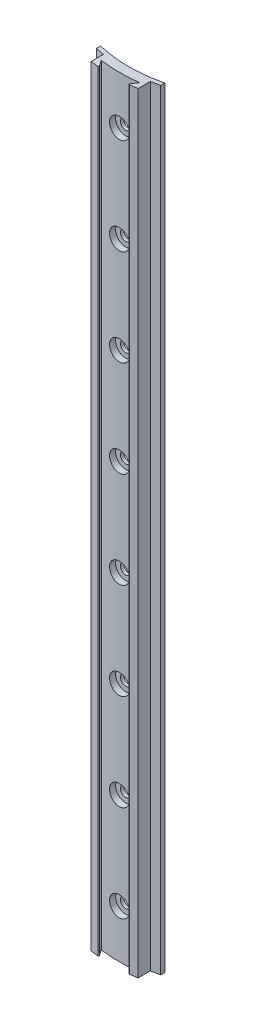
from build123d import *

# Parameters (mm, degrees)
BOSS_EXTRUDE1_DEPTH = 240
CUT_EXTRUDE3_DEPTH  = 245.479549247
BOSS_EXTRUDE2_DEPTH = 240
SKETCH3_R           = 1.625
CUT_EXTRUDE4_DEPTH  = 270
SKETCH3_5_R         = 3.125
SKETCH3_5_R_2       = 1.625
CUT_EXTRUDE5_DEPTH  = 2
CUT_EXTRUDE6_DEPTH  = 245.810237745


with BuildPart() as part:
    # Sketch2 → Boss-Extrude1 (new body)
    with BuildSketch(Plane(origin=(0, 15, 0), x_dir=(1, 0, 0), z_dir=(0, 1, 0))):
        with BuildLine():
            Line((-10, -44.38749824), (-10, -41.306779105))
            ThreePointArc((-10, -41.306779105), (0, -42.5), (10, -41.306779105))
            Line((10, -41.306779105), (10, -44.38749824))
            ThreePointArc((10, -44.38749824), (0, -45.5), (-10, -44.38749824))
        make_face()
    extrude(amount=BOSS_EXTRUDE1_DEPTH)

    # Sketch5 → Cut-Extrude3 (cut, through all)
    with BuildSketch(Plane(origin=(0, 255, 0), x_dir=(1, 0, 0), z_dir=(0, 1, 0))):
        with BuildLine():
            Line((-8, -42.991182168), (-8, -44.791182168))
            ThreePointArc((-8, -44.791182168), (-9.002263059, -44.600552237), (-10, -44.38749824))
            Line((-10, -44.38749824), (-10, -42.570432746))
            ThreePointArc((-10, -42.570432746), (-9.002458415, -42.792493345), (-8, -42.991182168))
        make_face()
        with BuildLine():
            Line((8, -44.791182168), (8, -42.991182168))
            ThreePointArc((8, -42.991182168), (9.002458415, -42.792493345), (10, -42.570432746))
            Line((10, -42.570432746), (10, -44.38749824))
            ThreePointArc((10, -44.38749824), (9.002263059, -44.600552237), (8, -44.791182168))
        make_face()
    extrude(amount=-CUT_EXTRUDE3_DEPTH, mode=Mode.SUBTRACT)

    # Sketch6 → Boss-Extrude2 (add, through all)
    with BuildSketch(Plane(origin=(0, 255, 0), x_dir=(1, 0, 0), z_dir=(0, 1, 0))):
        with BuildLine():
            Line((-8, -44.791182168), (-8, -46.821469434))
            ThreePointArc((-8, -46.821469434), (-6.468173714, -47.057546991), (-4.929460777, -47.243522481))
            ThreePointArc((-4.929460777, -47.243522481), (-4.736798282, -47.146817981), (-4.743851161, -46.931362988))
            Line((-4.743851161, -46.931362988), (-6, -45.102660675))
            ThreePointArc((-6, -45.102660675), (-7.001732265, -44.958044278), (-8, -44.791182168))
        make_face()
        with BuildLine():
            Line((8, -44.791182168), (8, -46.821469434))
            ThreePointArc((8, -46.821469434), (6.468173714, -47.057546991), (4.929460777, -47.243522481))
            ThreePointArc((4.929460777, -47.243522481), (4.736798282, -47.146817981), (4.743851161, -46.931362988))
            Line((4.743851161, -46.931362988), (6, -45.102660675))
            ThreePointArc((6, -45.102660675), (7.001732265, -44.958044278), (8, -44.791182168))
        make_face()
    extrude(amount=-BOSS_EXTRUDE2_DEPTH)

    # Sketch3 → Cut-Extrude4 (cut)
    with BuildSketch(Plane.XY.offset(45.5)):
        with Locations((0, 30)):
            Circle(SKETCH3_R)
        with Locations((0, 60)):
            Circle(SKETCH3_R)
        with Locations((0, 90)):
            Circle(SKETCH3_R)
        with Locations((0, 120)):
            Circle(SKETCH3_R)
        with Locations((0, 150)):
            Circle(SKETCH3_R)
        with Locations((0, 180)):
            Circle(SKETCH3_R)
        with Locations((0, 210)):
            Circle(SKETCH3_R)
        with Locations((0, 240)):
            Circle(SKETCH3_R)
    extrude(amount=-CUT_EXTRUDE4_DEPTH, mode=Mode.SUBTRACT)

    # Sketch3<5> → Cut-Extrude5 (cut)
    # profile 1 of 8: a face of its own
    with BuildSketch(Plane.XY.offset(45.5)):
        with Locations((0, 30)):
            Circle(SKETCH3_5_R)
        with Locations((0, 30)):
            Circle(SKETCH3_5_R_2, mode=Mode.SUBTRACT)
    # profile 2 of 8: a face of its own
    with BuildSketch(Plane.XY.offset(45.5)):
        with Locations((0, 60)):
            Circle(SKETCH3_5_R)
        with Locations((0, 60)):
            Circle(SKETCH3_5_R_2, mode=Mode.SUBTRACT)
    # profile 3 of 8: a face of its own
    with BuildSketch(Plane.XY.offset(45.5)):
        with Locations((0, 90)):
            Circle(SKETCH3_5_R)
        with Locations((0, 90)):
            Circle(SKETCH3_5_R_2, mode=Mode.SUBTRACT)
    # profile 4 of 8: a face of its own
    with BuildSketch(Plane.XY.offset(45.5)):
        with Locations((0, 120)):
            Circle(SKETCH3_5_R)
        with Locations((0, 120)):
            Circle(SKETCH3_5_R_2, mode=Mode.SUBTRACT)
    # profile 5 of 8: a face of its own
    with BuildSketch(Plane.XY.offset(45.5)):
        with Locations((0, 150)):
            Circle(SKETCH3_5_R)
        with Locations((0, 150)):
            Circle(SKETCH3_5_R_2, mode=Mode.SUBTRACT)
    # profile 6 of 8: a face of its own
    with BuildSketch(Plane.XY.offset(45.5)):
        with Locations((0, 180)):
            Circle(SKETCH3_5_R)
        with Locations((0, 180)):
            Circle(SKETCH3_5_R_2, mode=Mode.SUBTRACT)
    # profile 7 of 8: a face of its own
    with BuildSketch(Plane.XY.offset(45.5)):
        with Locations((0, 210)):
            Circle(SKETCH3_5_R)
        with Locations((0, 210)):
            Circle(SKETCH3_5_R_2, mode=Mode.SUBTRACT)
    # profile 8 of 8: a face of its own
    with BuildSketch(Plane.XY.offset(45.5)):
        with Locations((0, 240)):
            Circle(SKETCH3_5_R)
        with Locations((0, 240)):
            Circle(SKETCH3_5_R_2, mode=Mode.SUBTRACT)
    extrude(amount=-CUT_EXTRUDE5_DEPTH, mode=Mode.SUBTRACT)

    # Sketch8 → Cut-Extrude6 (cut, through all)
    with BuildSketch(Plane(origin=(0, 255, 0), x_dir=(1, 0, 0), z_dir=(0, 1, 0))):
        with BuildLine():
            Line((-7.3, -48.974342188), (-7.3, -43.115562668))
            ThreePointArc((-7.3, -43.115562668), (-8.65429325, -42.86426195), (-10, -42.570432746))
            Line((-10, -42.570432746), (-7.3, -48.974342188))
        make_face()
        with BuildLine():
            Line((7.3, -43.115562668), (7.3, -48.974342188))
            Line((7.3, -48.974342188), (10, -42.570432746))
            ThreePointArc((10, -42.570432746), (8.65429325, -42.86426195), (7.3, -43.115562668))
        make_face()
    extrude(amount=-CUT_EXTRUDE6_DEPTH, mode=Mode.SUBTRACT)


solid = part.part
